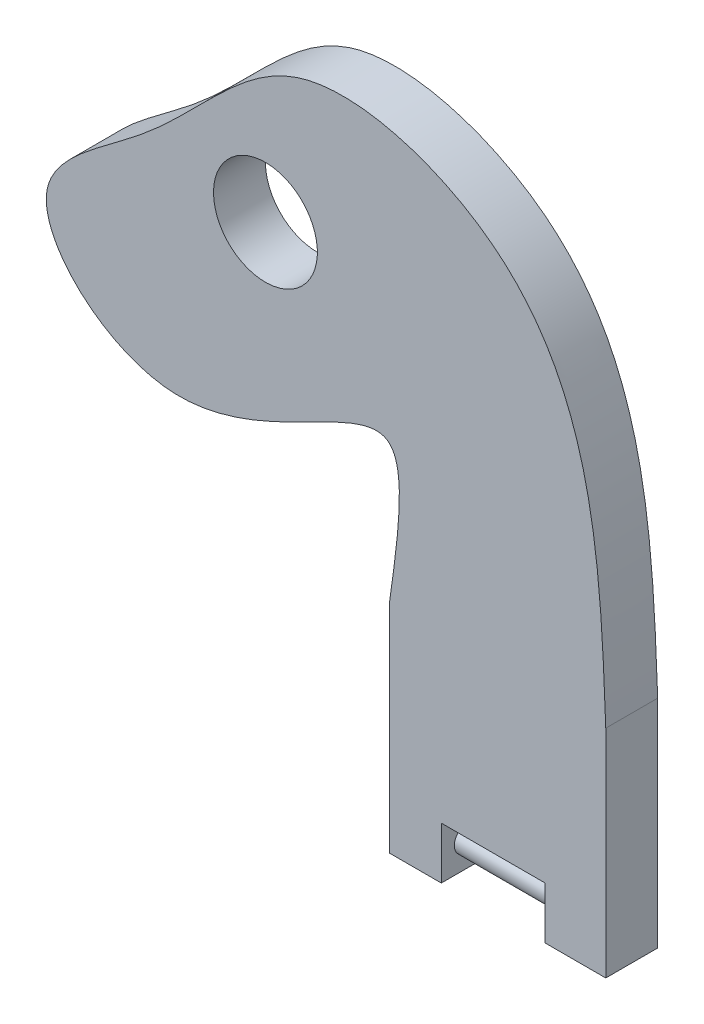
from build123d import *

# Parameters (mm, degrees)
CROQUIS1_R              = 6
SALIENTE_EXTRUIR1_DEPTH = 6
CROQUIS2_W              = 12
CROQUIS2_H              = 6
CORTAR_EXTRUIR1_DEPTH   = 10
SALIENTE_EXTRUIR2_REACH = 77.342
CROQUIS3_R              = 1.5


with BuildPart() as part:
    # Croquis1 → Saliente-Extruir1 (new body)
    with BuildSketch(Plane.XY):
        with BuildLine():
            Line((-25.176533916, -24.924128553), (-25.176533916, 0.075871447))
            add(Edge.make_bspline(
                [(-25.176533916, 0.075871447), (-24.177790677, 7.153043467), (-21.531429687, 25.905362586), (-48.167741219, -0.161154952), (-71.326371797, 21.694429053), (-49.692653611, 33.759482733), (-37.922931782, 52.371022295), (-1.788817545, 41.17030193), (-0.818277965, 16.432860822), (-0.176533916, 0.075871447)],
                knots=[0, 0, 0, 0, 0.095474073, 0.252976792, 0.366419691, 0.46115851, 0.604148925, 0.738253775, 1, 1, 1, 1], degree=3))
            Line((-0.176533916, 0.075871447), (-0.176533916, -24.924128553))
            Line((-0.176533916, -24.924128553), (-25.176533916, -24.924128553))
        make_face()
        with Locations(Location((-39.497448672, 31.029939944, 0), (0, 0, 180))):
            Circle(CROQUIS1_R, mode=Mode.SUBTRACT)
    extrude(amount=SALIENTE_EXTRUIR1_DEPTH)

    # Croquis2 → Cortar-Extruir1 (cut)
    with BuildSketch(Plane.XY.offset(6)):
        with Locations((-13.176533916, -21.924128553)):
            Rectangle(CROQUIS2_W, CROQUIS2_H)
    extrude(amount=-CORTAR_EXTRUIR1_DEPTH, mode=Mode.SUBTRACT)

    # Croquis3 → Saliente-Extruir2 (add, up to next)
    with BuildSketch(Plane.ZY.offset(7.176533916), mode=Mode.PRIVATE) as saliente_extruir2_sk1:
        with Locations(Location((3, -21.924128553, 0), (0, 0, 180))):
            Circle(CROQUIS3_R)
    saliente_extruir2_tool1 = extrude(saliente_extruir2_sk1.sketch, amount=SALIENTE_EXTRUIR2_REACH, mode=Mode.PRIVATE) - part.part
    add(saliente_extruir2_tool1.solids().sort_by_distance((-7.176534, -21.924129, 3))[0])


solid = part.part
